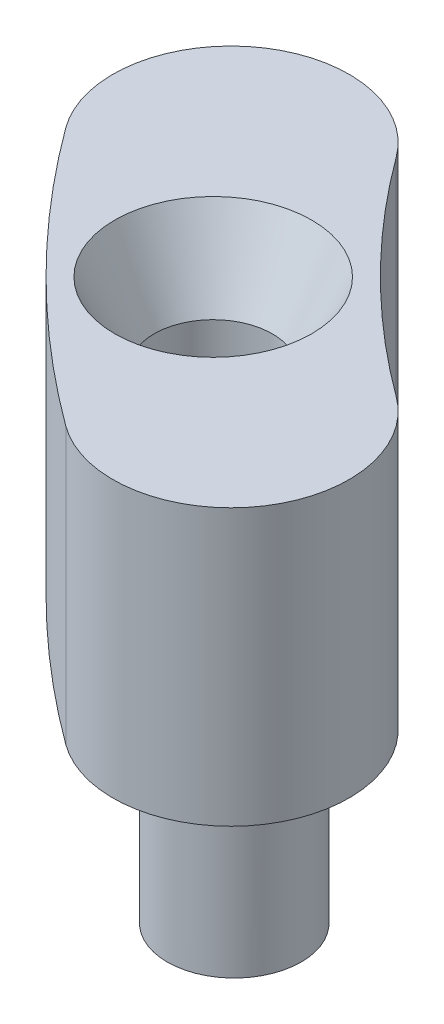
from build123d import *

# Parameters (mm, degrees)
SKETCH_1_R      = 1.5
EXTRUDE_1_DEPTH = 7
SKETCH_3_R      = 1.7
SKETCH_3_R_2    = 2
EXTRUDE_2_DEPTH = 4


with BuildPart() as part:
    # 草图1 → 凸台-拉伸1 (new body)
    with BuildSketch(Plane(origin=(0, 0, 0), x_dir=(1, 0, 0), z_dir=(0, 1, 0))):
        with BuildLine():
            ThreePointArc((-24.592495152, -18.040487305), (-21.566756826, -21.566756826), (-18.040487305, -24.592495152))
            ThreePointArc((-18.040487305, -24.592495152), (-13.847079195, -23.948035364), (-14.491538983, -19.754627253))
            ThreePointArc((-14.491538983, -19.754627253), (-17.324116139, -17.324116139), (-19.754627253, -14.491538983))
            ThreePointArc((-19.754627253, -14.491538983), (-23.948035364, -13.847079195), (-24.592495152, -18.040487305))
        make_face()
        with Locations((-19.445436483, -19.445436483)):
            Circle(SKETCH_1_R, mode=Mode.SUBTRACT)
    extrude(amount=EXTRUDE_1_DEPTH)

    # 草图2 → 切除-旋转1 (revolve, cut)
    with BuildSketch(Plane(origin=(-19.445436483, 0, 0), x_dir=(0, 0, -1), z_dir=(1, 0, 0))):
        Polygon((-19.445436483, 7), (-21.945436483, 7), (-20.695436483, 4.5), (-19.445436483, 4.5), align=None)
    revolve(axis=Axis((-19.445436483, 7, 19.445436483), (0, -1, 0)), mode=Mode.SUBTRACT)

    # 草图3 → 凸台-拉伸2 (add)
    with BuildSketch(Plane.XZ):
        with Locations((-15.969331282, 22.388176755)):
            Circle(SKETCH_3_R)
        with Locations((-22.388176755, 15.969331282)):
            Circle(SKETCH_3_R_2)
    extrude(amount=EXTRUDE_2_DEPTH)


solid = part.part
